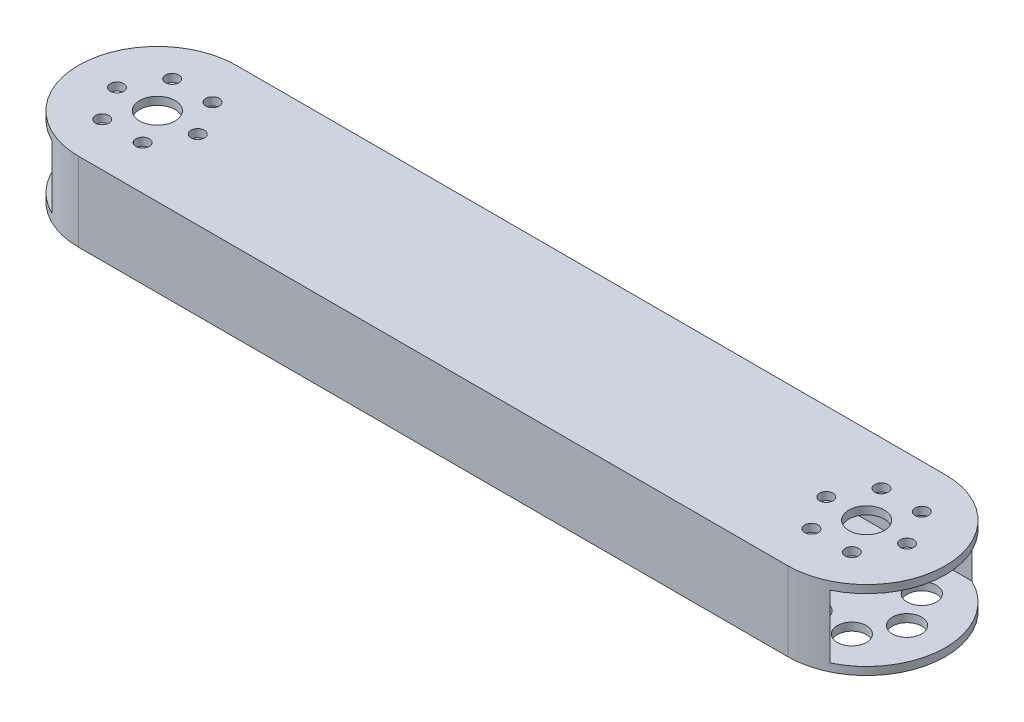
from build123d import *

# Parameters (mm, degrees)
SKIZZE1_W                       = 40
SKIZZE1_H                       = 20
SKIZZE1_W_2                     = 36
SKIZZE1_H_2                     = 16
AUFSATZ_LINEAR_AUSTRAGEN1_DEPTH = 220
SKIZZE2_R                       = 1.7
SCHNITT_LINEAR_AUSTRAGEN1_DEPTH = 222.810730128
SKIZZE4_R                       = 3.7
SCHNITT_LINEAR_AUSTRAGEN2_DEPTH = 5
SKIZZE2_3_R                     = 4.5
SCHNITT_LINEAR_AUSTRAGEN3_DEPTH = 5


with BuildPart() as part:
    # Skizze1 → Aufsatz-Linear austragen1 (new body)
    with BuildSketch(Plane(origin=(0, 0, 0), x_dir=(0, 0, -1), z_dir=(1, 0, 0))):
        Rectangle(SKIZZE1_W, SKIZZE1_H)
        Rectangle(SKIZZE1_W_2, SKIZZE1_H_2, mode=Mode.SUBTRACT)
    extrude(amount=AUFSATZ_LINEAR_AUSTRAGEN1_DEPTH)

    # Skizze2 → Schnitt-Linear austragen1 (cut, through all)
    with BuildSketch(Plane(origin=(0, 10, 0), x_dir=(1, 0, 0), z_dir=(0, 1, 0))):
        with BuildLine():
            Line((20, 20), (0, 20))
            Line((0, 20), (0, -4.7e-08))
            ThreePointArc((0, -4.7e-08), (5.85786436, 14.142135607), (20, 20))
        make_face()
        with BuildLine():
            ThreePointArc((20, -20), (5.857864393, -14.14213564), (0, -4.7e-08))
            Line((0, -4.7e-08), (0, -20))
            Line((0, -20), (20, -20))
        make_face()
        with BuildLine():
            Line((220, 20), (200, 20))
            ThreePointArc((200, 20), (214.142135624, 14.142135624), (220, 0))
            Line((220, 0), (220, 20))
        make_face()
        with BuildLine():
            ThreePointArc((220, 0), (214.142135624, -14.142135624), (200, -20))
            Line((200, -20), (220, -20))
            Line((220, -20), (220, 0))
        make_face()
        with Locations((30.25, 0)):
            Circle(SKIZZE2_R)
        with Locations((189.75, 0)):
            Circle(SKIZZE2_R)
        with Locations((25.125, -8.876760389)):
            Circle(SKIZZE2_R)
        with Locations((14.875, -8.876760389)):
            Circle(SKIZZE2_R)
        with Locations((9.75, 0)):
            Circle(SKIZZE2_R)
        with Locations((14.875, 8.876760389)):
            Circle(SKIZZE2_R)
        with Locations((25.125, 8.876760389)):
            Circle(SKIZZE2_R)
        with Locations((194.875, 8.876760389)):
            Circle(SKIZZE2_R)
        with Locations((205.125, 8.876760389)):
            Circle(SKIZZE2_R)
        with Locations((210.25, 0)):
            Circle(SKIZZE2_R)
        with Locations((205.125, -8.876760389)):
            Circle(SKIZZE2_R)
        with Locations((194.875, -8.876760389)):
            Circle(SKIZZE2_R)
    extrude(amount=-SCHNITT_LINEAR_AUSTRAGEN1_DEPTH, mode=Mode.SUBTRACT)

    # Skizze4 → Schnitt-Linear austragen2 (cut)
    with BuildSketch(Plane.XZ.offset(10)):
        with Locations((189.75, 0)):
            Circle(SKIZZE4_R)
        with Locations((194.875, -8.876760389)):
            Circle(SKIZZE4_R)
        with Locations((205.125, -8.876760389)):
            Circle(SKIZZE4_R)
        with Locations((210.25, 0)):
            Circle(SKIZZE4_R)
        with Locations((205.125, 8.876760389)):
            Circle(SKIZZE4_R)
        with Locations((194.875, 8.876760389)):
            Circle(SKIZZE4_R)
        with Locations((30.25, 0)):
            Circle(SKIZZE4_R)
        with Locations((25.125, -8.876760389)):
            Circle(SKIZZE4_R)
        with Locations((14.875, -8.876760389)):
            Circle(SKIZZE4_R)
        with Locations((9.75, 0)):
            Circle(SKIZZE4_R)
        with Locations((25.125, 8.876760389)):
            Circle(SKIZZE4_R)
        with Locations((14.875, 8.876760389)):
            Circle(SKIZZE4_R)
    extrude(amount=-SCHNITT_LINEAR_AUSTRAGEN2_DEPTH, mode=Mode.SUBTRACT)

    # Skizze2<3> → Schnitt-Linear austragen3 (cut)
    with BuildSketch(Plane(origin=(0, 10, 0), x_dir=(1, 0, 0), z_dir=(0, 1, 0))):
        with Locations((20, 0)):
            Circle(SKIZZE2_3_R)
        with Locations((200, 0)):
            Circle(SKIZZE2_3_R)
    extrude(amount=-SCHNITT_LINEAR_AUSTRAGEN3_DEPTH, mode=Mode.SUBTRACT)


solid = part.part
